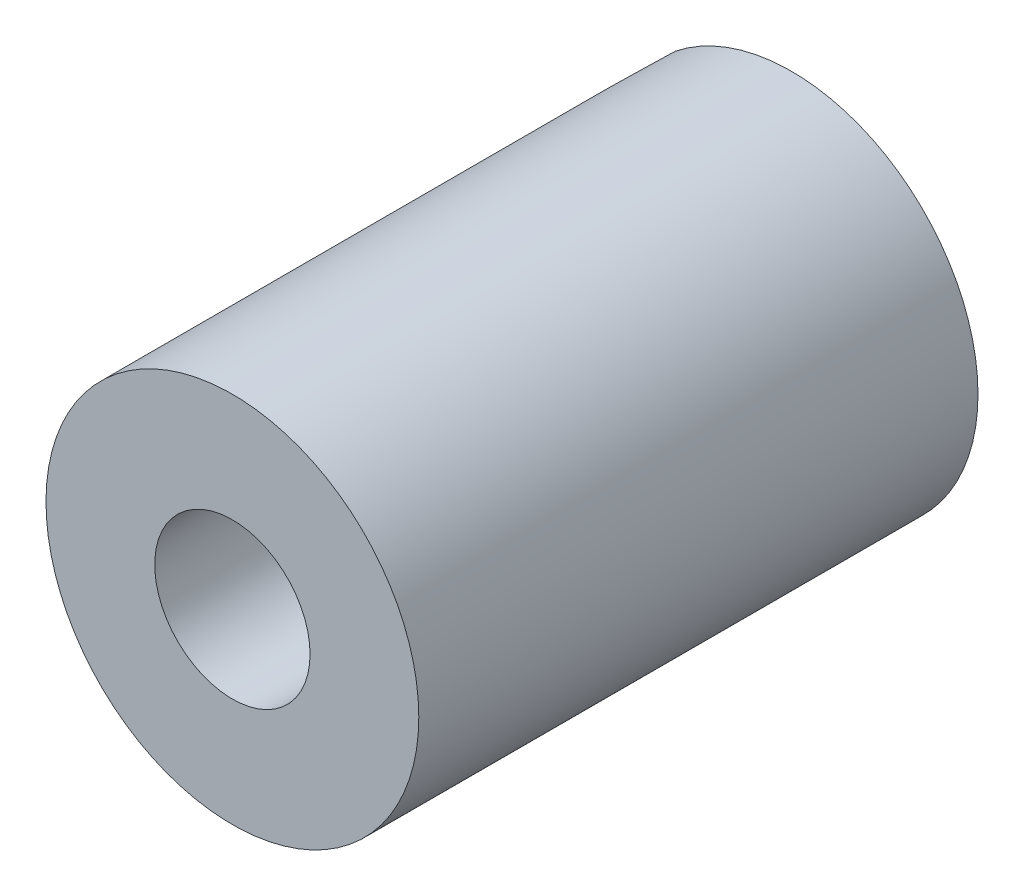
from build123d import *

# Parameters (mm, degrees)
ESQUISSE1_R             = 3
ESQUISSE1_R_2           = 1.25
BASE_EXTRUSION_DEPTH    = 9
ESQUISSE2_R             = 7
ENL_V_MAT_EXTRU_1_DEPTH = 5


with BuildPart() as part:
    # Esquisse1 → Base-Extrusion (new body)
    with BuildSketch(Plane.XY):
        Circle(ESQUISSE1_R)
        Circle(ESQUISSE1_R_2, mode=Mode.SUBTRACT)
    extrude(amount=BASE_EXTRUSION_DEPTH)

    # Esquisse2 → Enlèv. mat.-Extru.1 (cut, symmetric)
    with BuildSketch(Plane(origin=(0, 0, 0), x_dir=(1, 0, 0), z_dir=(0, 1, 0))):
        with Locations((-8.8, 1)):
            Circle(ESQUISSE2_R)
    extrude(amount=ENL_V_MAT_EXTRU_1_DEPTH, both=True, mode=Mode.SUBTRACT)


solid = part.part
